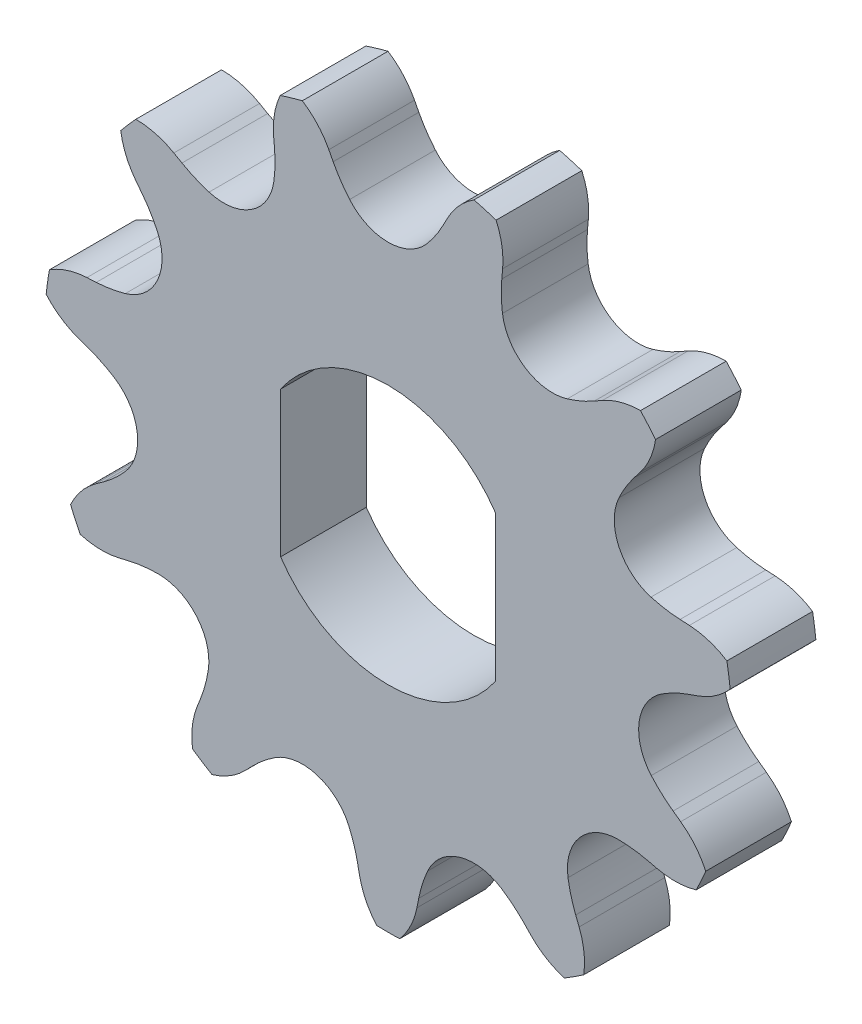
from build123d import *

# Parameters (mm, degrees)
ESQUISSE2_R                  = 11.836112132
BOSS_EXTRU_1_DEPTH           = 4
BOSS_EXTRU_2_START           = -4
BOSS_EXTRU_2_DEPTH           = 4
R_P_TITION_CIRCULAIRE1_COUNT = 11
ESQUISSE6_R                  = 16.559612132
ESQUISSE6_R_2                = 16.059612132
ENL_V_MAT_EXTRU_3_DEPTH      = 24.640803164
CUT_EXTRUDE1_DEPTH           = 10


with BuildPart() as part:
    # Esquisse2 → Boss.-Extru.1 (new body)
    with BuildSketch(Plane.XY):
        Circle(ESQUISSE2_R)
    extrude(amount=BOSS_EXTRU_1_DEPTH)

    # Esquisse3 → Boss.-Extru.2 (add)
    with BuildSketch(Plane.XY.offset(4).offset(BOSS_EXTRU_2_START)):
        with BuildLine():
            Line((-5.344448394, 13.436688428), (-5.305069319, 13.002458629))
            ThreePointArc((-5.305069319, 13.002458629), (-5.28156066, 12.313590322), (-5.335640108, 11.626445786))
            ThreePointArc((-5.335640108, 11.626445786), (-5.684064042, 10.675034327), (-6.399085338, 9.957171146))
            ThreePointArc((-6.399085338, 9.957171146), (-3.334618134, 11.356666425), (0, 11.836112132))
            ThreePointArc((0, 11.836112132), (-0.989620329, 12.053447371), (-1.797105063, 12.665453421))
            ThreePointArc((-1.797105063, 12.665453421), (-2.214097973, 13.214278633), (-2.566751555, 13.806501271))
            Line((-2.566751555, 13.806501271), (-2.768386123, 14.193088558))
            ThreePointArc((-2.768386123, 14.193088558), (-3.562335584, 15.213850424), (-4.665381866, 15.888831486))
            ThreePointArc((-4.665381866, 15.888831486), (-5.228401135, 14.72464944), (-5.344448394, 13.436688428))
        make_face()
    boss_extru_2 = extrude(amount=BOSS_EXTRU_2_DEPTH)

    # Répétition circulaire1: Boss.-Extru.2 ×11 about axis
    r_p_tition_circulaire1_axis = Axis((0, 0, 0), (0, 0, 1))
    for i in range(1, R_P_TITION_CIRCULAIRE1_COUNT):
        add(boss_extru_2.rotate(r_p_tition_circulaire1_axis, i * 360 / R_P_TITION_CIRCULAIRE1_COUNT))

    # Esquisse6 → Enlèv. mat.-Extru.3 (cut, through all)
    with BuildSketch(Plane(origin=(0, 0, 0), x_dir=(-1, 0, 0), z_dir=(0, 0, -1))):
        Circle(ESQUISSE6_R)
        Circle(ESQUISSE6_R_2, mode=Mode.SUBTRACT)
    extrude(amount=-ENL_V_MAT_EXTRU_3_DEPTH, mode=Mode.SUBTRACT)

    # Sketch1 → Cut-Extrude1 (cut)
    with BuildSketch(Plane.XY.offset(4)):
        with BuildLine():
            Line((-5.02, 3.39), (-5.02, -3.39))
            ThreePointArc((-5.02, -3.39), (0, -6.05743345), (5.02, -3.39))
            Line((5.02, -3.39), (5.02, 3.39))
            ThreePointArc((5.02, 3.39), (0, 6.05743345), (-5.02, 3.39))
        make_face()
    extrude(amount=-CUT_EXTRUDE1_DEPTH, mode=Mode.SUBTRACT)


solid = part.part
